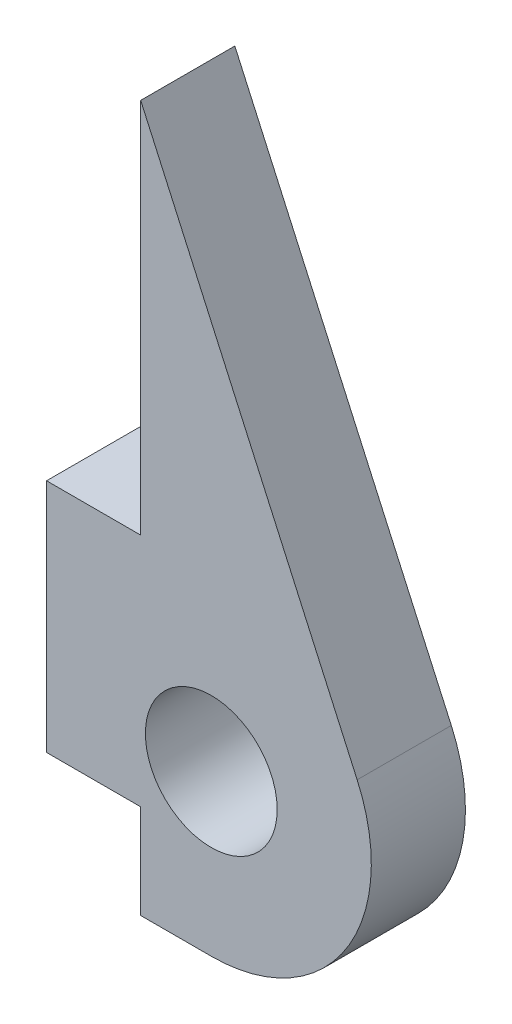
from build123d import *

# Parameters (mm, degrees)
SKETCH1_R           = 1.4
BOSS_EXTRUDE1_DEPTH = 2


with BuildPart() as part:
    # Sketch1 → Boss-Extrude1 (new body)
    with BuildSketch(Plane.XY):
        with BuildLine():
            Line((-1.5, -3.4), (-1.5, -1.4))
            Line((-1.5, -1.4), (-3.5, -1.4))
            Line((-3.5, -1.4), (-3.5, 3.6))
            Line((-3.5, 3.6), (-1.5, 3.6))
            Line((-1.5, 3.6), (-1.5, 11.6))
            Line((-1.5, 11.6), (3.099578521, 1.397359292))
            ThreePointArc((3.099578521, 1.397359292), (2.855785495, -1.845125796), (0, -3.4))
            Line((0, -3.4), (-1.5, -3.4))
        make_face()
        Circle(SKETCH1_R, mode=Mode.SUBTRACT)
    extrude(amount=BOSS_EXTRUDE1_DEPTH)


solid = part.part
